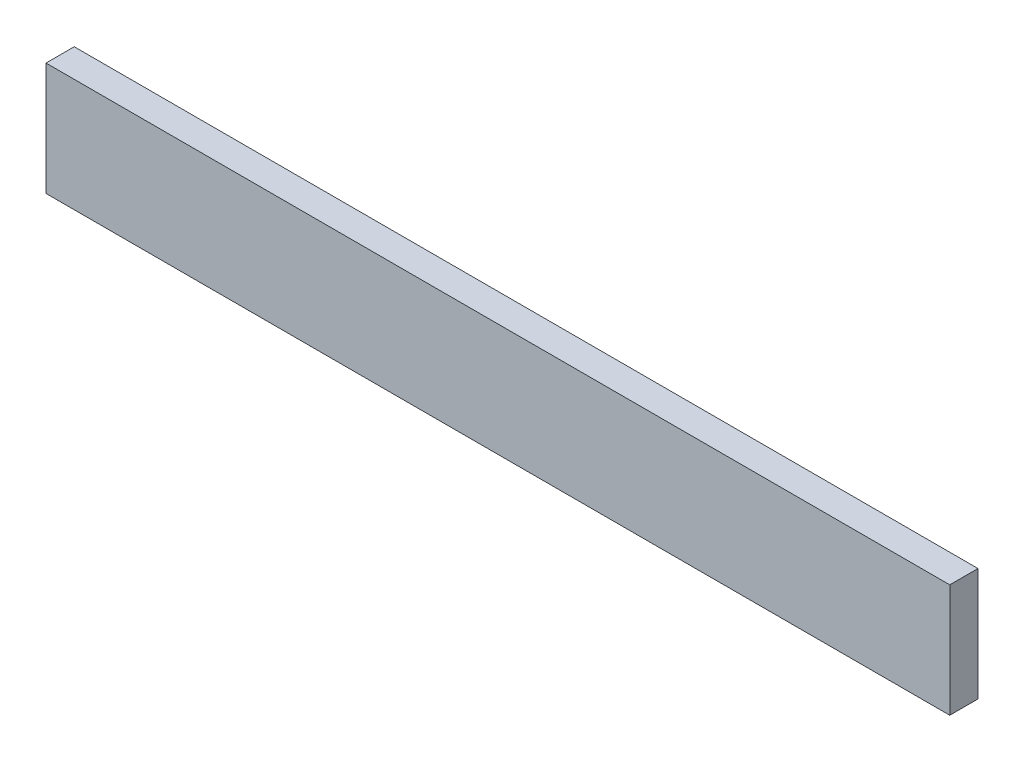
from build123d import *

# Parameters (mm, degrees)
CROQUIS1_W              = 320
CROQUIS1_H              = 40
SALIENTE_EXTRUIR1_DEPTH = 5
CROQUIS2_R              = 2.5
CORTAR_EXTRUIR1_DEPTH   = 5


with BuildPart() as part:
    # Croquis1 → Saliente-Extruir1 (new, symmetric)
    with BuildSketch(Plane.XY):
        Rectangle(CROQUIS1_W, CROQUIS1_H)
    extrude(amount=SALIENTE_EXTRUIR1_DEPTH, both=True)

    # Croquis2 → Cortar-Extruir1 (cut)
    with BuildSketch(Plane.XY):
        with Locations((155, 15)):
            Circle(CROQUIS2_R)
        with Locations((77.5, 15)):
            Circle(CROQUIS2_R)
        with Locations((0, 15)):
            Circle(CROQUIS2_R)
        with Locations((-77.5, 15)):
            Circle(CROQUIS2_R)
        with Locations((-155, 15)):
            Circle(CROQUIS2_R)
        with Locations(Location((155, -15, 0), (0, 0, 180))):
            Circle(CROQUIS2_R)
        with Locations(Location((77.5, -15, 0), (0, 0, 180))):
            Circle(CROQUIS2_R)
        with Locations(Location((0, -15, 0), (0, 0, 180))):
            Circle(CROQUIS2_R)
        with Locations(Location((-77.5, -15, 0), (0, 0, 180))):
            Circle(CROQUIS2_R)
        with Locations(Location((-155, -15, 0), (0, 0, 180))):
            Circle(CROQUIS2_R)
        with Locations((-155, 0)):
            Circle(CROQUIS2_R)
        with Locations(Location((155, 0, 0), (0, 0, 180))):
            Circle(CROQUIS2_R)
    extrude(amount=-CORTAR_EXTRUIR1_DEPTH, mode=Mode.SUBTRACT)


solid = part.part
